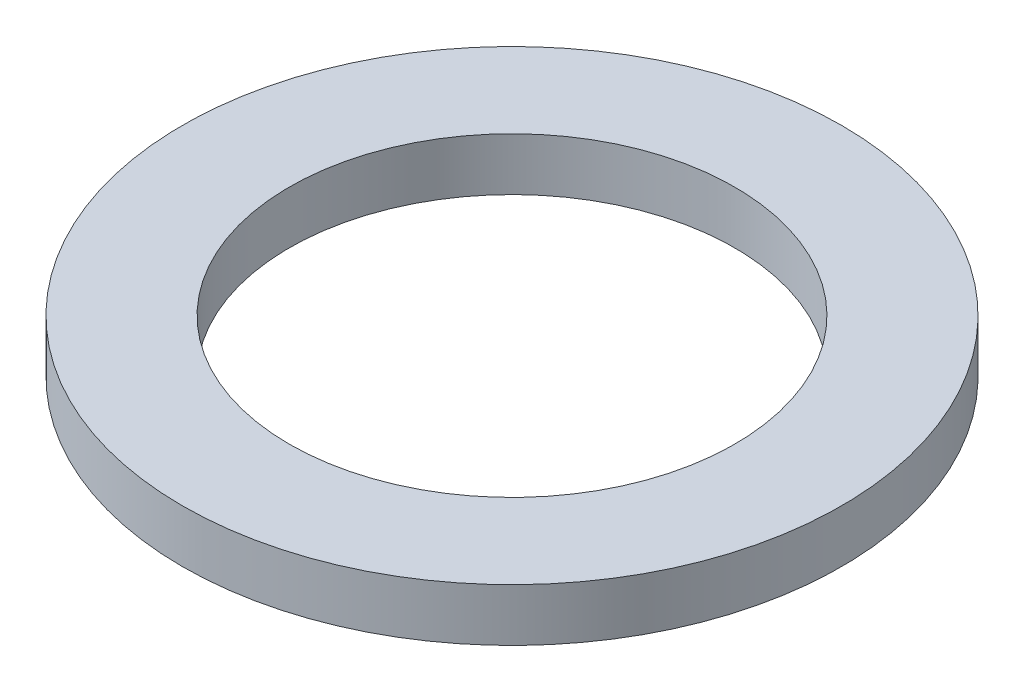
from build123d import *

# Parameters (mm, degrees)
SKETCH1_R           = 5.5626
BOSS_EXTRUDE1_DEPTH = 0.889
SKETCH5_R           = 3.7592
CUT_EXTRUDE1_DEPTH  = 8.916777029


with BuildPart() as part:
    # Sketch1 → Boss-Extrude1 (new body)
    with BuildSketch(Plane(origin=(0, 0, 0), x_dir=(1, 0, 0), z_dir=(0, 1, 0))):
        with Locations(Location((0, 0, 0), (0, 0, 270))):
            Circle(SKETCH1_R)
    extrude(amount=BOSS_EXTRUDE1_DEPTH)

    # Sketch5 → Cut-Extrude1 (cut, through all)
    with BuildSketch(Plane(origin=(0, 0.889, 0), x_dir=(-1, 0, 0), z_dir=(0, 1, 0))):
        with Locations(Location((0, 0, 0), (0, 0, 90))):
            Circle(SKETCH5_R)
    extrude(amount=-CUT_EXTRUDE1_DEPTH, mode=Mode.SUBTRACT)


solid = part.part
